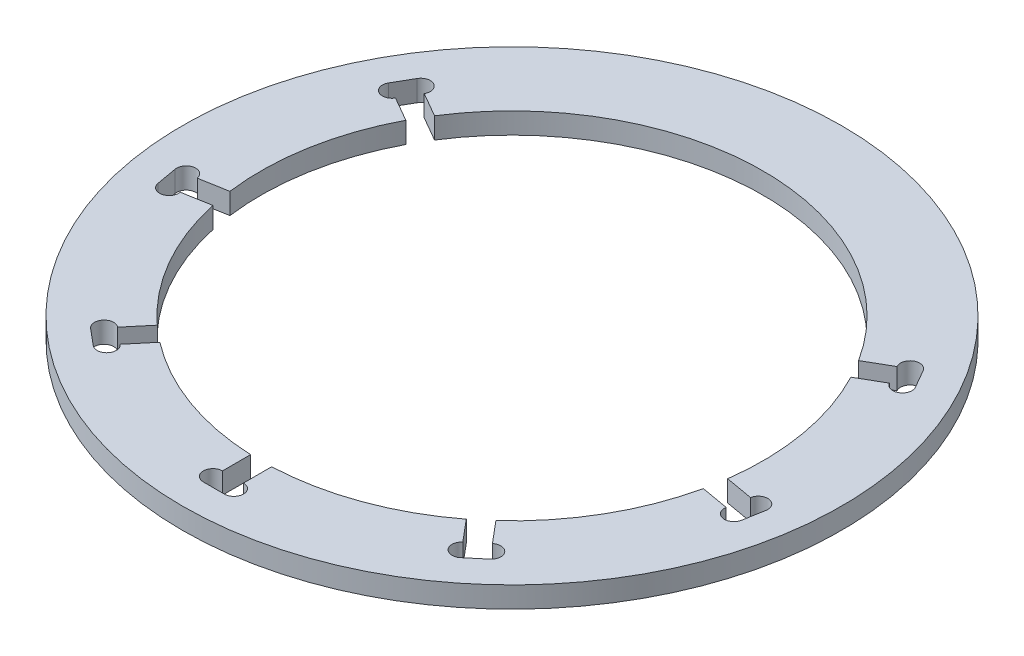
from build123d import *

# Parameters (mm, degrees)
SKETCH1_R           = 105
SKETCH1_R_2         = 80
BOSS_EXTRUDE1_DEPTH = 6.7
CUT_EXTRUDE3_DEPTH  = 6.7


with BuildPart() as part:
    # Sketch1 → Boss-Extrude1 (new body)
    with BuildSketch(Plane(origin=(0, 0, 0), x_dir=(1, 0, 0), z_dir=(0, 1, 0))):
        with Locations(Location((0, 0, 0), (0, 0, 270))):
            Circle(SKETCH1_R)
        with Locations(Location((0, 0, 0), (0, 0, 270))):
            Circle(SKETCH1_R_2, mode=Mode.SUBTRACT)
    extrude(amount=BOSS_EXTRUDE1_DEPTH)

    # Sketch2 → Cut-Extrude3 (cut)
    with BuildSketch(Plane(origin=(0, 6.7, 0), x_dir=(1, 0, 0), z_dir=(0, 1, 0))):
        with BuildLine():
            Line((88.131130638, -12.138217022), (74.442302871, -9.724507352))
            Line((74.442302871, -9.724507352), (73.278860081, -16.322719298))
            Line((73.278860081, -16.322719298), (86.967687848, -18.736428967))
            ThreePointArc((86.967687848, -18.736428967), (89.441724552, -22.269719556), (92.975015141, -19.795682851))
            Line((92.975015141, -19.795682851), (94.138457931, -13.197470906))
            ThreePointArc((94.138457931, -13.197470906), (91.664421227, -9.664180317), (88.131130638, -12.138217022))
        make_face()
        with BuildLine():
            Line((75.314658396, 47.351185103), (63.276905284, 40.401185103))
            Line((63.276905284, 40.401185103), (66.626905284, 34.598814897))
            Line((66.626905284, 34.598814897), (78.664658396, 41.548814897))
            ThreePointArc((78.664658396, 41.548814897), (82.831035878, 40.432437416), (83.94741336, 44.598814897))
            Line((83.94741336, 44.598814897), (80.59741336, 50.401185103))
            ThreePointArc((80.59741336, 50.401185103), (76.431035878, 51.517562584), (75.314658396, 47.351185103))
        make_face()
        with BuildLine():
            Line((59.710067386, -65.948012501), (50.775319611, -55.299994741))
            Line((50.775319611, -55.299994741), (45.642821842, -59.606671726))
            Line((45.642821842, -59.606671726), (54.577569617, -70.254689486))
            ThreePointArc((54.577569617, -70.254689486), (54.201636275, -74.551627247), (58.498574036, -74.927560589))
            Line((58.498574036, -74.927560589), (63.631071805, -70.620883604))
            ThreePointArc((63.631071805, -70.620883604), (64.007005147, -66.323945843), (59.710067386, -65.948012501))
        make_face()
        with BuildLine():
            Line((3.35, -88.9), (3.35, -75))
            Line((3.35, -75), (-3.35, -75))
            Line((-3.35, -75), (-3.35, -88.9))
            ThreePointArc((-3.35, -88.9), (-6.4, -91.95), (-3.35, -95))
            Line((-3.35, -95), (3.35, -95))
            ThreePointArc((3.35, -95), (6.4, -91.95), (3.35, -88.9))
        make_face()
        with BuildLine():
            Line((-54.577569617, -70.254689486), (-45.642821842, -59.606671726))
            Line((-45.642821842, -59.606671726), (-50.775319611, -55.299994741))
            Line((-50.775319611, -55.299994741), (-59.710067386, -65.948012501))
            ThreePointArc((-59.710067386, -65.948012501), (-64.007005147, -66.323945843), (-63.631071805, -70.620883604))
            Line((-63.631071805, -70.620883604), (-58.498574036, -74.927560589))
            ThreePointArc((-58.498574036, -74.927560589), (-54.201636275, -74.551627247), (-54.577569617, -70.254689486))
        make_face()
        with BuildLine():
            Line((-86.967687848, -18.736428967), (-73.278860081, -16.322719298))
            Line((-73.278860081, -16.322719298), (-74.442302871, -9.724507352))
            Line((-74.442302871, -9.724507352), (-88.131130638, -12.138217022))
            ThreePointArc((-88.131130638, -12.138217022), (-91.664421227, -9.664180317), (-94.138457931, -13.197470906))
            Line((-94.138457931, -13.197470906), (-92.975015141, -19.795682851))
            ThreePointArc((-92.975015141, -19.795682851), (-89.441724552, -22.269719556), (-86.967687848, -18.736428967))
        make_face()
        with BuildLine():
            Line((-78.664658396, 41.548814897), (-66.626905284, 34.598814897))
            Line((-66.626905284, 34.598814897), (-63.276905284, 40.401185103))
            Line((-63.276905284, 40.401185103), (-75.314658396, 47.351185103))
            ThreePointArc((-75.314658396, 47.351185103), (-76.431035878, 51.517562584), (-80.59741336, 50.401185103))
            Line((-80.59741336, 50.401185103), (-83.94741336, 44.598814897))
            ThreePointArc((-83.94741336, 44.598814897), (-82.831035878, 40.432437416), (-78.664658396, 41.548814897))
        make_face()
    extrude(amount=-CUT_EXTRUDE3_DEPTH, mode=Mode.SUBTRACT)


solid = part.part
